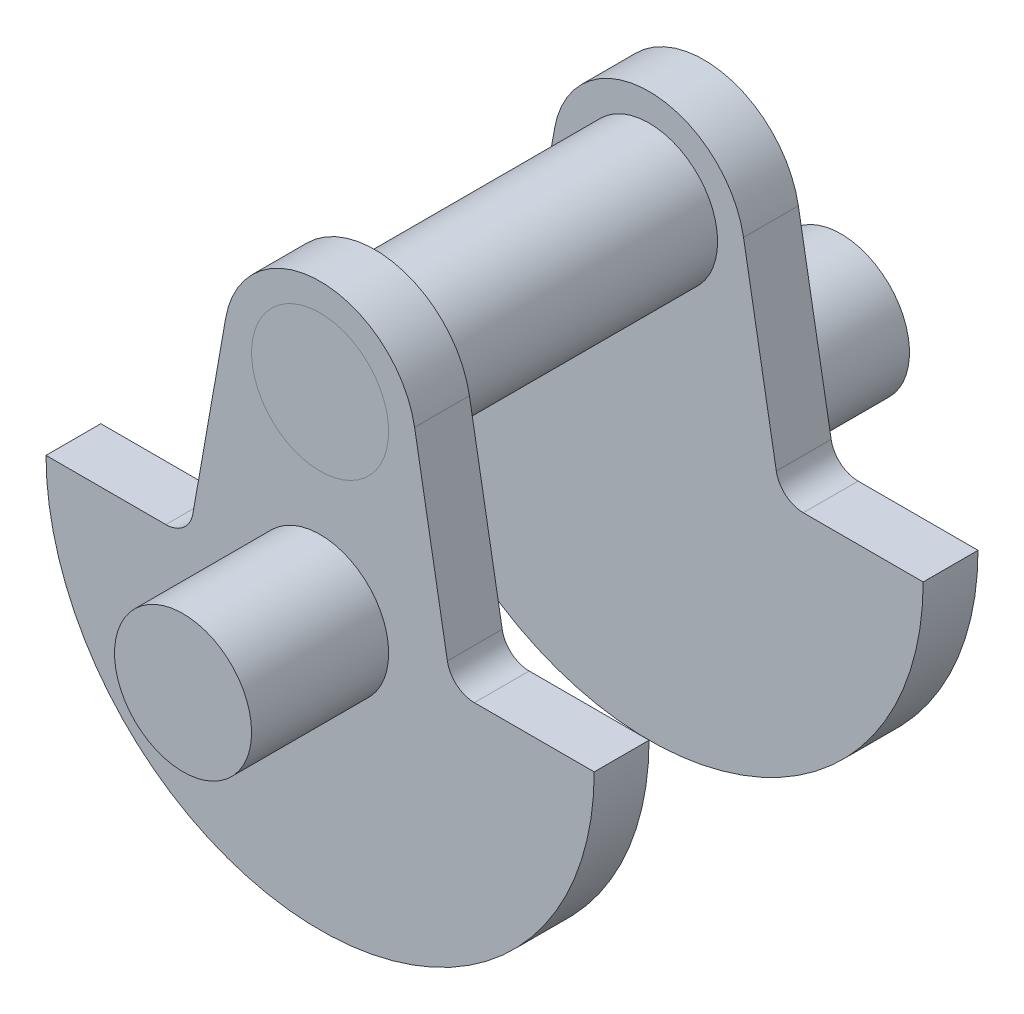
from build123d import *

# Parameters (mm, degrees)
SKETCH1_R                = 12.5
BOSS_EXTRUDE1_DEPTH      = 10
BOSS_EXTRUDE2_DEPTH      = 10
BOSS_EXTRUDE2_DEPTH_BACK = 50
SKETCH1_2_R              = 12.5
SKETCH1_3_R              = 12.5
BOSS_EXTRUDE3_DEPTH      = 35
BOSS_EXTRUDE4_START      = 10
SKETCH3_R                = 12.5
BOSS_EXTRUDE4_DEPTH      = 10
BOSS_EXTRUDE5_START      = 35
SKETCH3_3_R              = 12.5
BOSS_EXTRUDE5_DEPTH      = 35


with BuildPart() as part:
    # Sketch1 → Boss-Extrude1 (new body)
    with BuildSketch(Plane.XY):
        with BuildLine():
            Line((-50, 0), (-28.136908189, 0))
            ThreePointArc((-28.136908189, 0), (-24.92297014, 1.169777784), (-23.212869424, 4.131759112))
            Line((-23.212869424, 4.131759112), (-17.234135678, 38.038843109))
            ThreePointArc((-17.234135678, 38.038843109), (0, 52.5), (17.234135678, 38.038843109))
            Line((17.234135678, 38.038843109), (23.212869424, 4.131759112))
            ThreePointArc((23.212869424, 4.131759112), (24.92297014, 1.169777784), (28.136908189, 0))
            Line((28.136908189, 0), (50, 0))
            ThreePointArc((50, 0), (0, -50), (-50, 0))
        make_face()
        Circle(SKETCH1_R, mode=Mode.SUBTRACT)
        with Locations((0, 35)):
            Circle(SKETCH1_R, mode=Mode.SUBTRACT)
    extrude(amount=BOSS_EXTRUDE1_DEPTH)

    # Sketch1<3> → Boss-Extrude3 (add)
    with BuildSketch(Plane.XY):
        Circle(SKETCH1_3_R)
    extrude(amount=BOSS_EXTRUDE3_DEPTH)


with BuildPart() as body_2:
    # Sketch1<2> → Boss-Extrude2 (new, two sides: drawn at the far end of the back side and taken through both)
    with BuildSketch(Plane.XY.offset(-BOSS_EXTRUDE2_DEPTH_BACK)):
        with Locations((0, 35)):
            Circle(SKETCH1_2_R)
    extrude(amount=BOSS_EXTRUDE2_DEPTH + BOSS_EXTRUDE2_DEPTH_BACK)

    # Sketch3 → Boss-Extrude4 (add)
    with BuildSketch(Plane(origin=(0, 0, -50), x_dir=(-1, 0, 0), z_dir=(0, 0, -1)).offset(BOSS_EXTRUDE4_START)):
        with BuildLine():
            ThreePointArc((-50, 0), (0, -50), (50, 0))
            Line((50, 0), (28.136908189, 0))
            ThreePointArc((28.136908189, 0), (24.92297014, 1.169777784), (23.212869424, 4.131759112))
            Line((23.212869424, 4.131759112), (17.234135678, 38.038843109))
            ThreePointArc((17.234135678, 38.038843109), (0, 52.5), (-17.234135678, 38.038843109))
            Line((-17.234135678, 38.038843109), (-23.212869424, 4.131759112))
            ThreePointArc((-23.212869424, 4.131759112), (-24.92297014, 1.169777784), (-28.136908189, 0))
            Line((-28.136908189, 0), (-50, 0))
        make_face()
        Circle(SKETCH3_R, mode=Mode.SUBTRACT)
    extrude(amount=-BOSS_EXTRUDE4_DEPTH)

    # Sketch3<3> → Boss-Extrude5 (add)
    with BuildSketch(Plane(origin=(0, 0, -50), x_dir=(-1, 0, 0), z_dir=(0, 0, -1)).offset(BOSS_EXTRUDE5_START)):
        Circle(SKETCH3_3_R)
    extrude(amount=-BOSS_EXTRUDE5_DEPTH)


solid = Compound([part.part, body_2.part])
